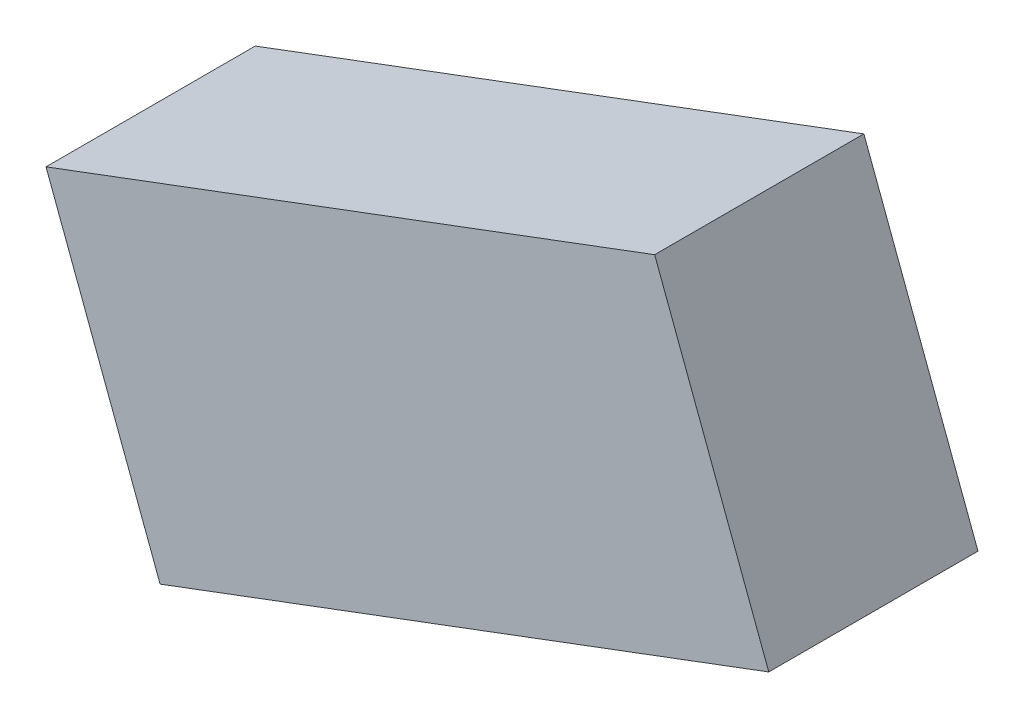
from build123d import *

# Parameters (mm, degrees)
BOSS_EXTRUDE1_DEPTH = 11


with BuildPart() as part:
    # Sketch1 → Boss-Extrude1 (new body)
    with BuildSketch(Plane.XY):
        Polygon((3, 4), (35, 16), (29, 32), (-3, 20), align=None)
    extrude(amount=BOSS_EXTRUDE1_DEPTH)


solid = part.part
